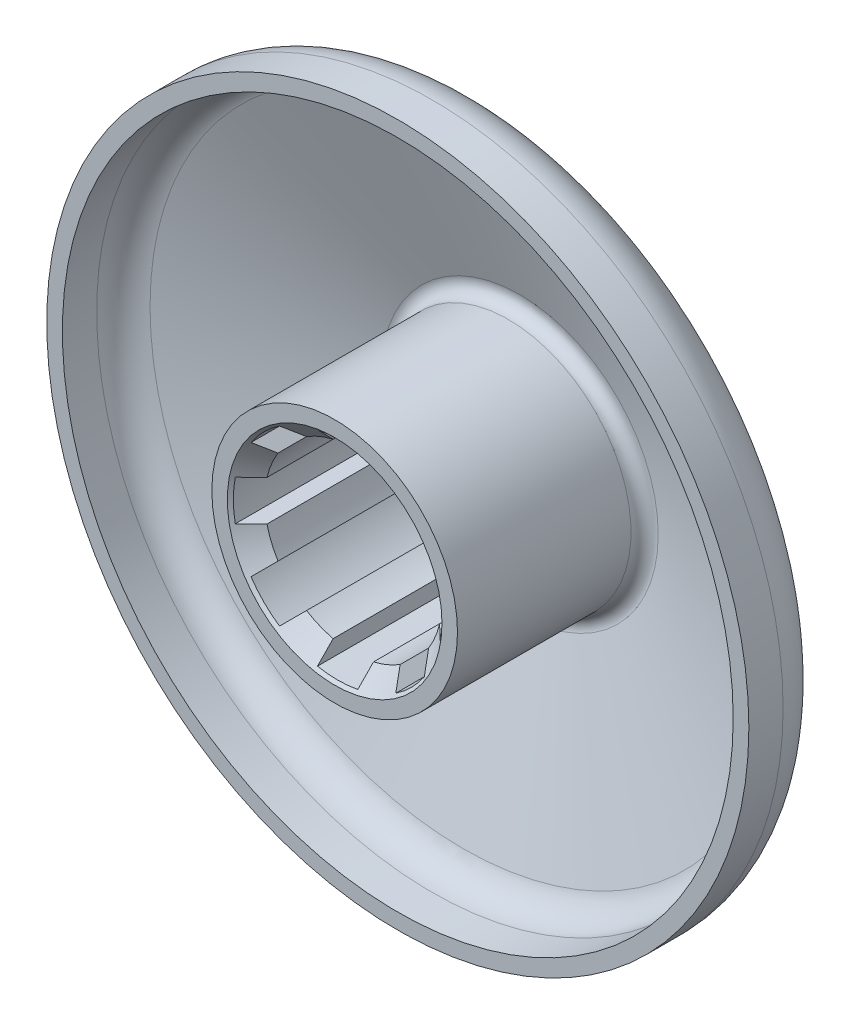
from build123d import *

# Parameters (mm, degrees)
SKETCH1_R           = 20.4
SKETCH1_R_2         = 14.725
BOSS_EXTRUDE1_DEPTH = 34.3
FILLET1_R           = 8
FILLET2_R           = 5.4
CUT_EXTRUDE1_DEPTH  = 90.29876936
CIRPATTERN1_COUNT   = 8
FILLET3_R           = 10
CHAMFER1_SIZE       = 1
FILLET4_R           = 2


with BuildPart() as part:
    # Sketch1 → Boss-Extrude1 (new body)
    with BuildSketch(Plane.XY):
        Circle(SKETCH1_R)
        Circle(SKETCH1_R_2, mode=Mode.SUBTRACT)
    extrude(amount=BOSS_EXTRUDE1_DEPTH)

    # Sketch3 → Revolve1 (revolve)
    with BuildSketch(Plane(origin=(0, 0, 0), x_dir=(1, 0, 0), z_dir=(0, 1, 0)), mode=Mode.PRIVATE) as revolve1_sk:
        Polygon((-20.4, 0), (-58.3, -12.314456487), (-58.3, -23.814456487), (-55.7, -23.814456487), (-55.7, -14.20346706), (-20.4, -2.733801783), align=None)
    revolve(revolve1_sk.sketch.rotate(Axis((0, 0, 0), (0, 0, -1)), 180), axis=Axis((0, 0, 0), (0, 0, -1)))

    # Fillet1
    fillet1_edges = [part.edges().sort_by_distance(p)[0] for p in [
        (-58.3, 0, 12.314456487),
    ]]
    fillet(fillet1_edges, radius=FILLET1_R)

    # Fillet2
    fillet2_edges = [part.edges().sort_by_distance(p)[0] for p in [
        (-55.7, 0, 14.20346706),
    ]]
    fillet(fillet2_edges, radius=FILLET2_R)

    # Sketch4 → Cut-Extrude1 (cut, through all)
    with BuildSketch(Plane(origin=(0, 0, 0), x_dir=(-1, 0, 0), z_dir=(0, 0, -1))):
        with BuildLine():
            Line((-3.35, 14.338867633), (-3.35, 16.998032974))
            ThreePointArc((-3.35, 16.998032974), (0, 17.325), (3.35, 16.998032974))
            Line((3.35, 16.998032974), (3.35, 14.338867633))
            ThreePointArc((3.35, 14.338867633), (0, 14.725), (-3.35, 14.338867633))
        make_face()
    cut_extrude1 = extrude(amount=-CUT_EXTRUDE1_DEPTH, mode=Mode.SUBTRACT)

    # CirPattern1: Cut-Extrude1 ×8 about axis
    cirpattern1_axis = Axis((0, 0, 0), (0, 0, 1))
    for i in range(1, CIRPATTERN1_COUNT):
        add(cut_extrude1.rotate(cirpattern1_axis, i * 360 / CIRPATTERN1_COUNT), mode=Mode.SUBTRACT)

    # Fillet3
    fillet3_edges = [part.edges().sort_by_distance(p)[0] for p in [
        (-20.4, 0, 0),
    ]]
    fillet(fillet3_edges, radius=FILLET3_R)

    # Sketch5 → Cut-Revolve1 (revolve, cut)
    with BuildSketch(Plane(origin=(0, 0, 0), x_dir=(1, 0, 0), z_dir=(0, 1, 0))):
        Polygon((-17.325, -34.3), (-17.325, -33.8), (-13.825, -30.3), (-13.825, -34.3), align=None)
        Polygon((-17.825, -34.3), (-17.325, -33.8), (-17.325, -34.3), align=None)
    revolve(axis=Axis((0, 0, 0), (0, 0, -1)), mode=Mode.SUBTRACT)

    # Chamfer1
    chamfer1_edges = [part.edges().sort_by_distance(p)[0] for p in [
        (-13.604126116, -5.635013542, 0),
        (-13.604126116, 5.635013542, 0),
        (-5.635013542, 13.604126116, 0),
        (5.635013542, 13.604126116, 0),
        (13.604126116, 5.635013542, 0),
        (13.604126116, -5.635013542, 0),
        (5.635013542, -13.604126116, 0),
        (-5.635013542, -13.604126116, 0),
    ]]
    chamfer(chamfer1_edges, length=CHAMFER1_SIZE)

    # Fillet4
    fillet4_edges = [part.edges().sort_by_distance(p)[0] for p in [
        (-20.4, 0, 2.733801783),
    ]]
    fillet(fillet4_edges, radius=FILLET4_R)


solid = part.part
